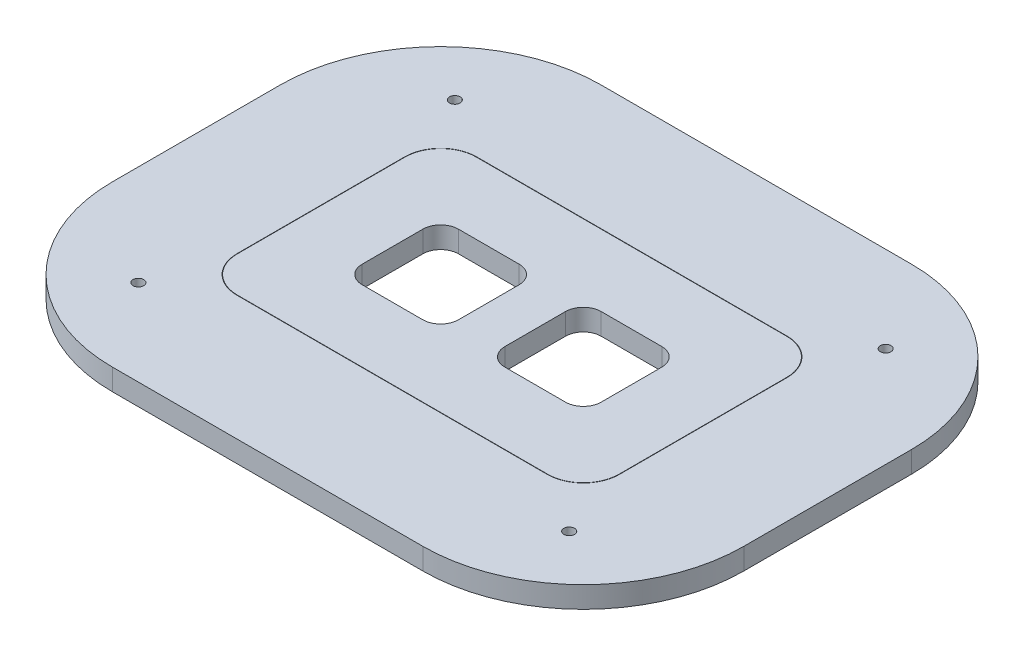
from build123d import *

# Parameters (mm, degrees)
BOSS_EXTRUDE1_DEPTH = 6
SKETCH2_R           = 1.5
BOSS_EXTRUDE2_DEPTH = 6


with BuildPart() as part:
    # Sketch1 → Boss-Extrude1 (new body)
    with BuildSketch(Plane(origin=(0, 0, 0), x_dir=(1, 0, 0), z_dir=(0, 1, 0))):
        with BuildLine():
            Line((-43.5, -33.5), (43.5, -33.5))
            ThreePointArc((43.5, -33.5), (50.571067812, -30.571067812), (53.5, -23.5))
            Line((53.5, -23.5), (53.5, 23.5))
            ThreePointArc((53.5, 23.5), (50.571067812, 30.571067812), (43.5, 33.5))
            Line((43.5, 33.5), (-43.5, 33.5))
            ThreePointArc((-43.5, 33.5), (-50.571067812, 30.571067812), (-53.5, 23.5))
            Line((-53.5, 23.5), (-53.5, -23.5))
            ThreePointArc((-53.5, -23.5), (-50.571067812, -30.571067812), (-43.5, -33.5))
        make_face()
        with BuildLine():
            Line((-28.5, -13.5), (-11.5, -13.5))
            ThreePointArc((-11.5, -13.5), (-7.964466094, -12.035533906), (-6.5, -8.5))
            Line((-6.5, -8.5), (-6.5, 8.5))
            ThreePointArc((-6.5, 8.5), (-7.964466094, 12.035533906), (-11.5, 13.5))
            Line((-11.5, 13.5), (-28.5, 13.5))
            ThreePointArc((-28.5, 13.5), (-32.035533906, 12.035533906), (-33.5, 8.5))
            Line((-33.5, 8.5), (-33.5, -8.5))
            ThreePointArc((-33.5, -8.5), (-32.035533906, -12.035533906), (-28.5, -13.5))
        make_face(mode=Mode.SUBTRACT)
        with BuildLine():
            Line((11.5, -13.5), (28.5, -13.5))
            ThreePointArc((28.5, -13.5), (32.035533906, -12.035533906), (33.5, -8.5))
            Line((33.5, -8.5), (33.5, 8.5))
            ThreePointArc((33.5, 8.5), (32.035533906, 12.035533906), (28.5, 13.5))
            Line((28.5, 13.5), (11.5, 13.5))
            ThreePointArc((11.5, 13.5), (7.964466094, 12.035533906), (6.5, 8.5))
            Line((6.5, 8.5), (6.5, -8.5))
            ThreePointArc((6.5, -8.5), (7.964466094, -12.035533906), (11.5, -13.5))
        make_face(mode=Mode.SUBTRACT)
    extrude(amount=BOSS_EXTRUDE1_DEPTH)


with BuildPart() as body_2:
    # Sketch2 → Boss-Extrude2 (new body)
    with BuildSketch(Plane(origin=(0, 6, 0), x_dir=(1, 0, 0), z_dir=(0, 1, 0))):
        with BuildLine():
            Line((-43.5, -68.5), (43.5, -68.5))
            ThreePointArc((43.5, -68.5), (75.319805153, -55.319805153), (88.5, -23.5))
            Line((88.5, -23.5), (88.5, 23.5))
            ThreePointArc((88.5, 23.5), (75.319805153, 55.319805153), (43.5, 68.5))
            Line((43.5, 68.5), (-43.5, 68.5))
            ThreePointArc((-43.5, 68.5), (-75.319805153, 55.319805153), (-88.5, 23.5))
            Line((-88.5, 23.5), (-88.5, -23.5))
            ThreePointArc((-88.5, -23.5), (-75.319805153, -55.319805153), (-43.5, -68.5))
        make_face()
        with Locations(Location((-60.390998648, 44.355110471, 0), (0, 0, 270))):
            Circle(SKETCH2_R, mode=Mode.SUBTRACT)
        with Locations(Location((60.390998648, 44.355110471, 0), (0, 0, 90))):
            Circle(SKETCH2_R, mode=Mode.SUBTRACT)
        with Locations(Location((-60.390998648, -44.355110471, 0), (0, 0, 90))):
            Circle(SKETCH2_R, mode=Mode.SUBTRACT)
        with Locations(Location((60.390998648, -44.355110471, 0), (0, 0, 270))):
            Circle(SKETCH2_R, mode=Mode.SUBTRACT)
        with BuildLine():
            Line((-43.5, -33.6), (43.5, -33.6))
            ThreePointArc((43.5, -33.6), (50.64177849, -30.64177849), (53.6, -23.5))
            Line((53.6, -23.5), (53.6, 23.5))
            ThreePointArc((53.6, 23.5), (50.64177849, 30.64177849), (43.5, 33.6))
            Line((43.5, 33.6), (-43.5, 33.6))
            ThreePointArc((-43.5, 33.6), (-50.64177849, 30.64177849), (-53.6, 23.5))
            Line((-53.6, 23.5), (-53.6, -23.5))
            ThreePointArc((-53.6, -23.5), (-50.64177849, -30.64177849), (-43.5, -33.6))
        make_face(mode=Mode.SUBTRACT)
    extrude(amount=-BOSS_EXTRUDE2_DEPTH)


solid = Compound([part.part, body_2.part])
